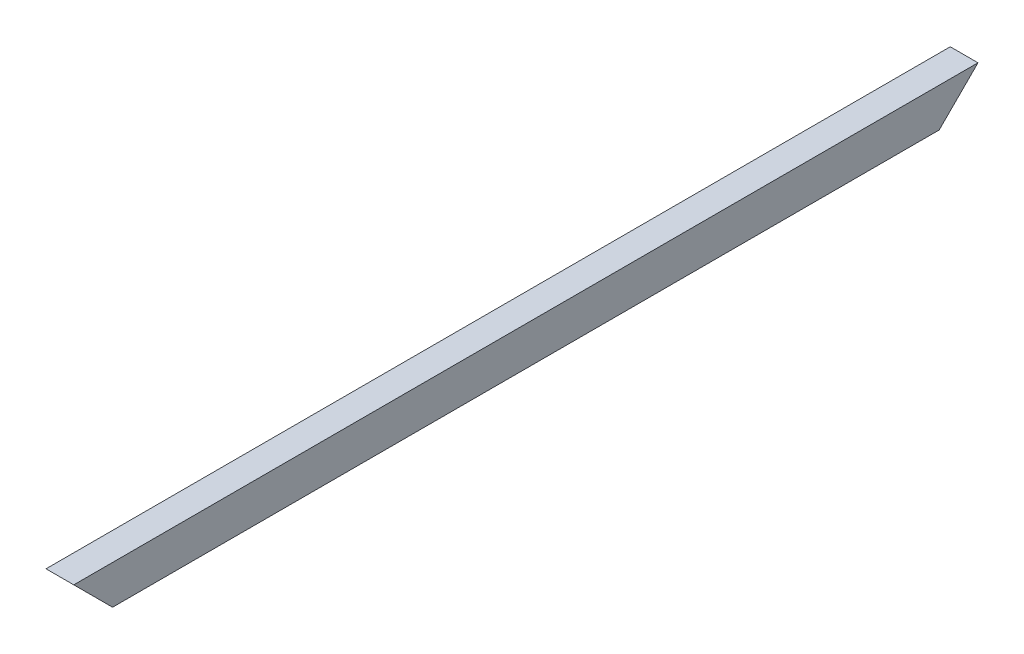
from build123d import *

# Parameters (mm, degrees)
BASE_EXTRUDE_DEPTH = 315
CUT_EXTRUDE1_DEPTH = 328.294614629


with BuildPart() as part:
    # Sketch1 → Base-Extrude (new, symmetric)
    with BuildSketch(Plane.XY):
        with BuildLine():
            Line((17.889139296, 87.044491269), (-1.453845178, 87.044491269))
            Line((-1.453845178, 87.044491269), (-1.453845178, 80.35203196))
            ThreePointArc((-1.453845178, 80.35203196), (-0.32181751, 77.619075411), (2.411139039, 76.487047743))
            Line((2.411139039, 76.487047743), (2.411139039, 73.52781514))
            ThreePointArc((2.411139039, 73.52781514), (5.658603705, 72.483207804), (7.688030184, 69.741190405))
            Line((7.688030184, 69.741190405), (7.688030184, 66.961115937))
            ThreePointArc((7.688030184, 66.961115937), (9.575663464, 62.192626492), (14.215671126, 60.00814031))
            Line((14.215671126, 60.00814031), (17.889139296, 60.00814031))
            Line((17.889139296, 60.00814031), (17.889139296, 87.044491269))
        make_face()
    extrude(amount=BASE_EXTRUDE_DEPTH, both=True)

    # Sketch2 → Cut-Extrude1 (cut, symmetric)
    with BuildSketch(Plane(origin=(0, 0, 0), x_dir=(0, 0, -1), z_dir=(1, 0, 0))):
        Polygon((315, 87.044491269), (255, 27.044491269), (315, 27.044491269), align=None)
    cut_extrude1 = extrude(amount=CUT_EXTRUDE1_DEPTH, both=True, mode=Mode.SUBTRACT)

    # Mirror1: Cut-Extrude1 across plane
    add(cut_extrude1.mirror(Plane.XY), mode=Mode.SUBTRACT)


solid = part.part
